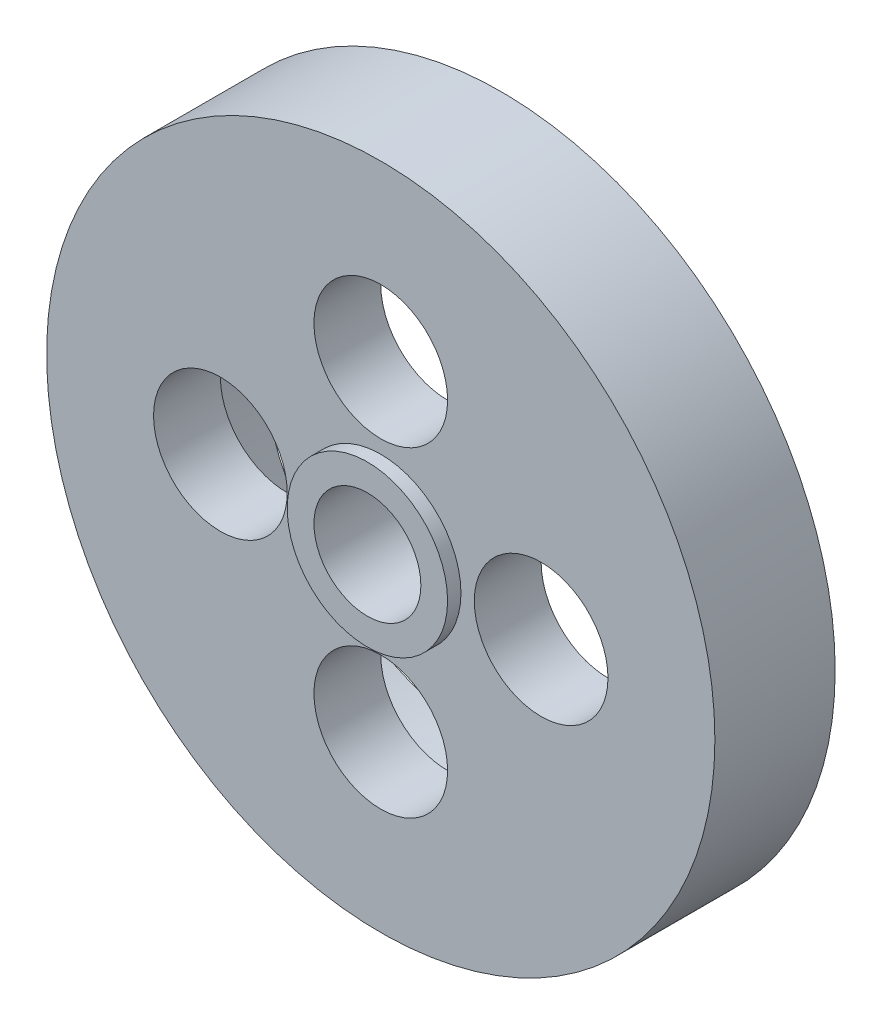
from build123d import *

# Parameters (mm, degrees)
SKETCH2_R           = 25
SKETCH2_R_2         = 5
SKETCH2_R_3         = 4
BOSS_EXTRUDE1_DEPTH = 9
SKETCH3_R           = 18
CUT_EXTRUDE1_DEPTH  = 4
SKETCH4_R           = 6
SKETCH4_R_2         = 4
BOSS_EXTRUDE2_DEPTH = 1


with BuildPart() as part:
    # Sketch2 → Boss-Extrude1 (new body)
    with BuildSketch(Plane.XY):
        Circle(SKETCH2_R)
        with Locations((0, 12)):
            Circle(SKETCH2_R_2, mode=Mode.SUBTRACT)
        with Locations((12, 0)):
            Circle(SKETCH2_R_2, mode=Mode.SUBTRACT)
        with Locations((0, -12)):
            Circle(SKETCH2_R_2, mode=Mode.SUBTRACT)
        with Locations((-12, 0)):
            Circle(SKETCH2_R_2, mode=Mode.SUBTRACT)
        Circle(SKETCH2_R_3, mode=Mode.SUBTRACT)
    extrude(amount=BOSS_EXTRUDE1_DEPTH)

    # Sketch3 → Cut-Extrude1 (cut)
    with BuildSketch(Plane(origin=(0, 0, 0), x_dir=(-1, 0, 0), z_dir=(0, 0, -1))):
        Circle(SKETCH3_R)
    extrude(amount=-CUT_EXTRUDE1_DEPTH, mode=Mode.SUBTRACT)

    # Sketch4 → Boss-Extrude2 (add)
    with BuildSketch(Plane.XY.offset(9)):
        Circle(SKETCH4_R)
        with Locations(Location((0, 0, 0), (0, 0, 180))):
            Circle(SKETCH4_R_2, mode=Mode.SUBTRACT)
    extrude(amount=BOSS_EXTRUDE2_DEPTH)


solid = part.part
